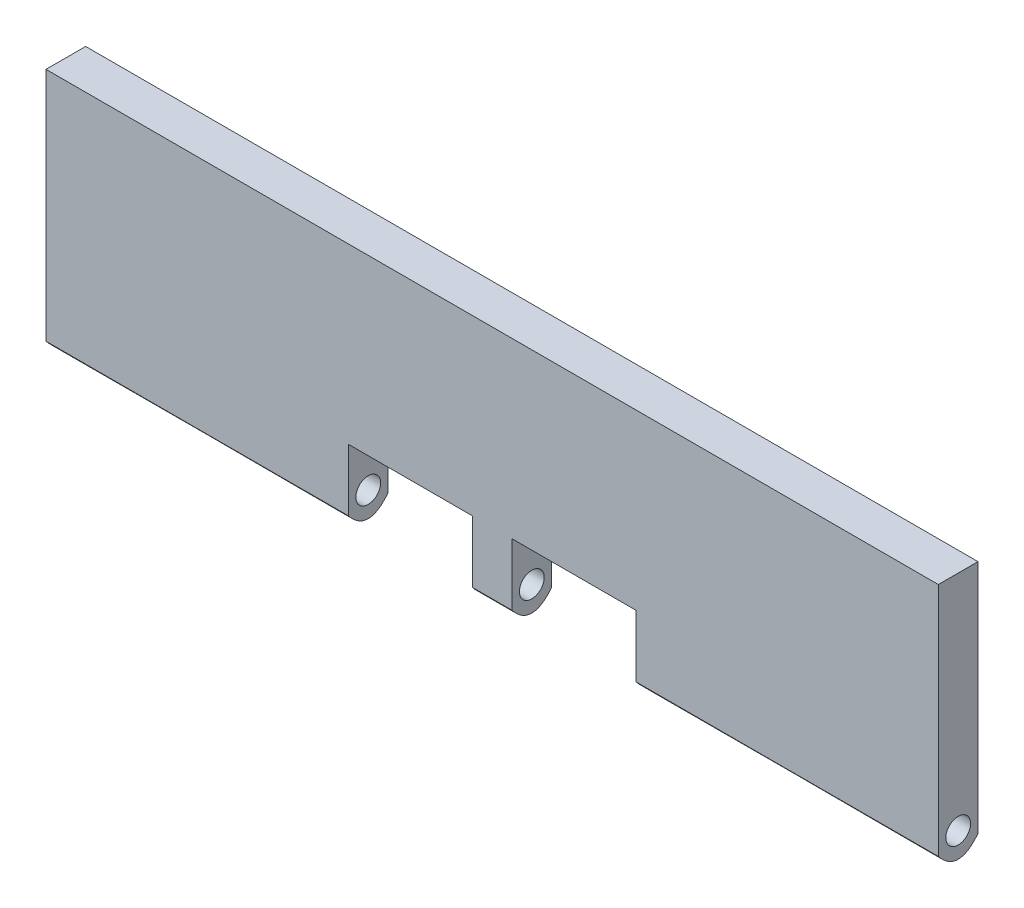
from build123d import *

# Parameters (mm, degrees)
BOSS_EXTRU_1_DEPTH      = 8
ENL_V_MAT_EXTRU_1_REACH = 183.904
ESQUISSE2_R             = 2.5
BOSS_EXTRU_2_DEPTH      = 2.5
BOSS_EXTRU_2_DEPTH_BACK = 2.5
ESQUISSE4_R             = 2.5


with BuildPart() as part:
    # Esquisse1 → Boss.-Extru.1 (new body)
    with BuildSketch(Plane.XY):
        Polygon((-29, -25), (-29, -10), (-4, -10), (-4, -25), (4, -25), (4, -10), (29, -10), (29, -25), (90, -25), (90, 25), (-90, 25), (-90, -25), align=None)
    extrude(amount=BOSS_EXTRU_1_DEPTH)

    # Enlèv. mat.-Extru.1: up to this face of the body (flat: up to its plane)
    enl_v_mat_extru_1_end = Plane(part.part.faces().sort_by_distance((90, 0, 4))[0])
    # Esquisse2 → Enlèv. mat.-Extru.1 (cut, up to the picked face)
    with BuildSketch(Plane.ZY.offset(90), mode=Mode.PRIVATE) as enl_v_mat_extru_1_sk1:
        with BuildLine():
            add(Edge.make_bspline(
                [(4, -25), (6, -25), (8, -22.5)],
                knots=[0.5, 0.5, 0.5, 1, 1, 1], degree=2))
            Line((4, -25), (8, -25))
            Line((8, -25), (8, -22.5))
        make_face()
    enl_v_mat_extru_1_tool1 = split(extrude(enl_v_mat_extru_1_sk1.sketch, amount=-ENL_V_MAT_EXTRU_1_REACH, mode=Mode.PRIVATE), bisect_by=enl_v_mat_extru_1_end, keep=Keep.BOTH, mode=Mode.PRIVATE)
    # Esquisse2 → Enlèv. mat.-Extru.1 (cut, up to the picked face)
    with BuildSketch(Plane.ZY.offset(90), mode=Mode.PRIVATE) as enl_v_mat_extru_1_sk2:
        with BuildLine():
            add(Edge.make_bspline(
                [(0, -22.5), (2, -25), (4, -25)],
                knots=[0, 0, 0, 0.5, 0.5, 0.5], degree=2))
            Line((0, -22.5), (0, -25))
            Line((0, -25), (4, -25))
        make_face()
    enl_v_mat_extru_1_tool2 = split(extrude(enl_v_mat_extru_1_sk2.sketch, amount=-ENL_V_MAT_EXTRU_1_REACH, mode=Mode.PRIVATE), bisect_by=enl_v_mat_extru_1_end, keep=Keep.BOTH, mode=Mode.PRIVATE)
    # Esquisse2 → Enlèv. mat.-Extru.1 (cut, up to the picked face)
    with BuildSketch(Plane.ZY.offset(90), mode=Mode.PRIVATE) as enl_v_mat_extru_1_sk3:
        with Locations((4, -20)):
            Circle(ESQUISSE2_R)
    enl_v_mat_extru_1_tool3 = split(extrude(enl_v_mat_extru_1_sk3.sketch, amount=-ENL_V_MAT_EXTRU_1_REACH, mode=Mode.PRIVATE), bisect_by=enl_v_mat_extru_1_end, keep=Keep.BOTH, mode=Mode.PRIVATE)
    add(enl_v_mat_extru_1_tool1.solids().sort_by(Axis((-90, -24.25, 7), (1, 0, 0)))[0], mode=Mode.SUBTRACT)
    add(enl_v_mat_extru_1_tool2.solids().sort_by(Axis((-90, -24.25, 1), (1, 0, 0)))[0], mode=Mode.SUBTRACT)
    add(enl_v_mat_extru_1_tool3.solids().sort_by(Axis((-90, -20, 4), (1, 0, 0)))[0], mode=Mode.SUBTRACT)

    # Esquisse4 → Boss.-Extru.2 (add, two sides: drawn at the far end of the back side and taken through both)
    with BuildSketch(Plane(origin=(0, 0, 0), x_dir=(0, 0, -1), z_dir=(1, 0, 0)).offset(-BOSS_EXTRU_2_DEPTH_BACK)):
        with BuildLine():
            Line((5, 4.5), (0, 4.5))
            Line((0, 4.5), (0, -4.5))
            Line((0, -4.5), (5, -4.5))
            ThreePointArc((5, -4.5), (9.5, 0), (5, 4.5))
        make_face()
        with Locations((5, 0)):
            Circle(ESQUISSE4_R, mode=Mode.SUBTRACT)
    extrude(amount=BOSS_EXTRU_2_DEPTH + BOSS_EXTRU_2_DEPTH_BACK)


solid = part.part
